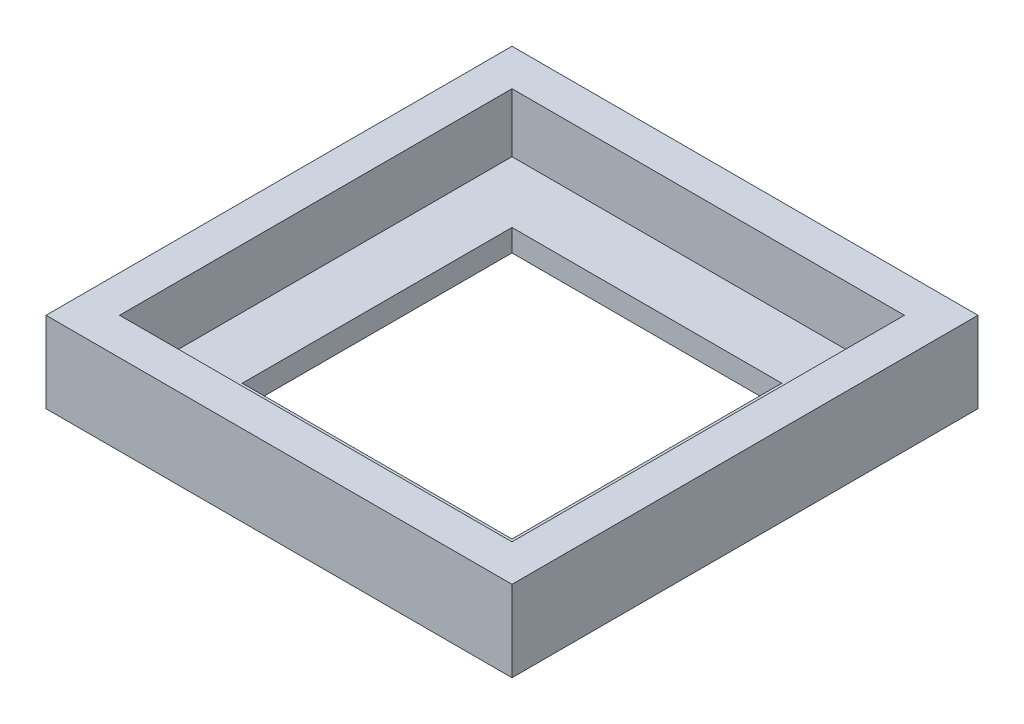
from build123d import *

# Parameters (mm, degrees)
SKETCH1_W           = 38
SKETCH1_H           = 38
SKETCH1_W_2         = 22
SKETCH1_H_2         = 22
BOSS_EXTRUDE1_DEPTH = 1.8
SKETCH2_W           = 38
SKETCH2_H           = 38
SKETCH2_W_2         = 32
SKETCH2_H_2         = 32
BOSS_EXTRUDE2_DEPTH = 4.8


with BuildPart() as part:
    # Sketch1 → Boss-Extrude1 (new body)
    with BuildSketch(Plane(origin=(0, 0, 0), x_dir=(1, 0, 0), z_dir=(0, 1, 0))):
        with Locations((19, 19)):
            Rectangle(SKETCH1_W, SKETCH1_H)
        with Locations((19, 19)):
            Rectangle(SKETCH1_W_2, SKETCH1_H_2, mode=Mode.SUBTRACT)
    extrude(amount=BOSS_EXTRUDE1_DEPTH)

    # Sketch2 → Boss-Extrude2 (add)
    with BuildSketch(Plane(origin=(0, 1.8, 0), x_dir=(1, 0, 0), z_dir=(0, 1, 0))):
        with Locations((19, 19)):
            Rectangle(SKETCH2_W, SKETCH2_H)
        with Locations((19, 19)):
            Rectangle(SKETCH2_W_2, SKETCH2_H_2, mode=Mode.SUBTRACT)
    extrude(amount=BOSS_EXTRUDE2_DEPTH)


solid = part.part
